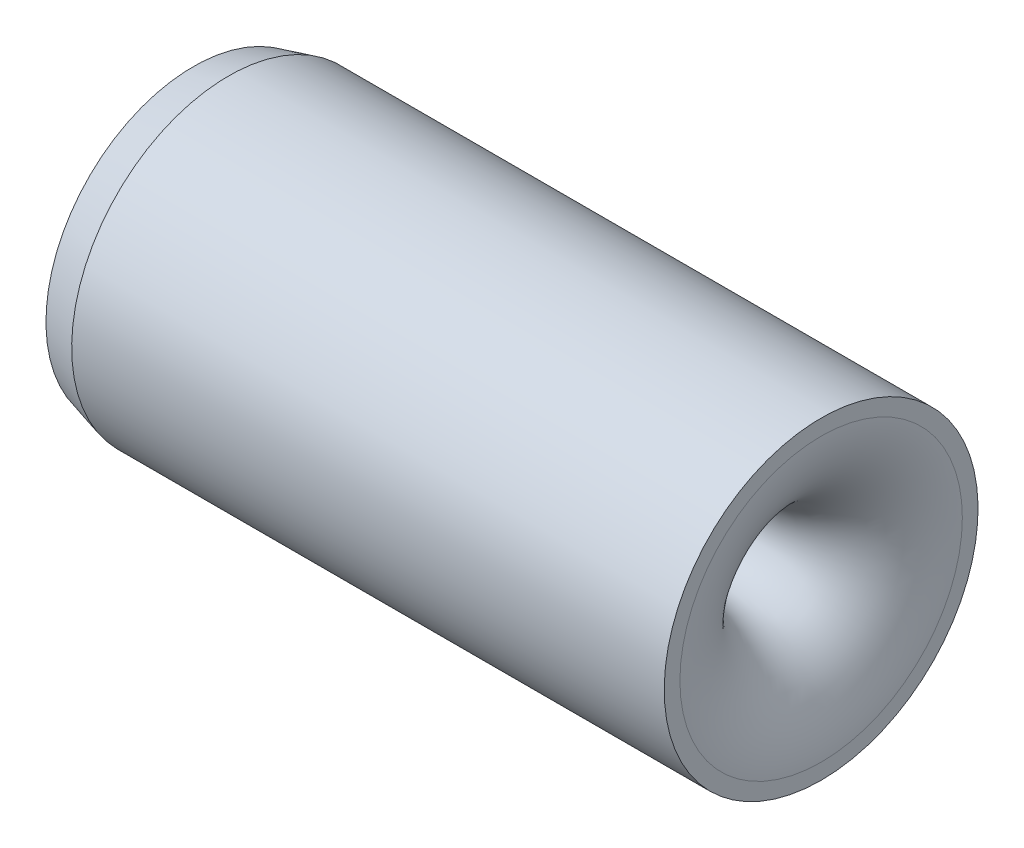
from build123d import *


with BuildPart() as part:
    # Sketch1 → Revolve1 (revolve)
    with BuildSketch(Plane.XY):
        with BuildLine():
            Line((-3, 1.41), (-2.664115427, 1.5))
            Line((-2.664115427, 1.5), (3, 1.5))
            Line((3, 1.5), (3, 1.35))
            ThreePointArc((3, 1.35), (2.707106781, 0.642893219), (2, 0.35))
            Line((2, 0.35), (-2, 0.35))
            ThreePointArc((-2, 0.35), (-2.707106781, 0.642893219), (-3, 1.35))
            Line((-3, 1.35), (-3, 1.41))
        make_face()
    revolve(axis=Axis((-3, 0, 0), (1, 0, 0)))


solid = part.part
